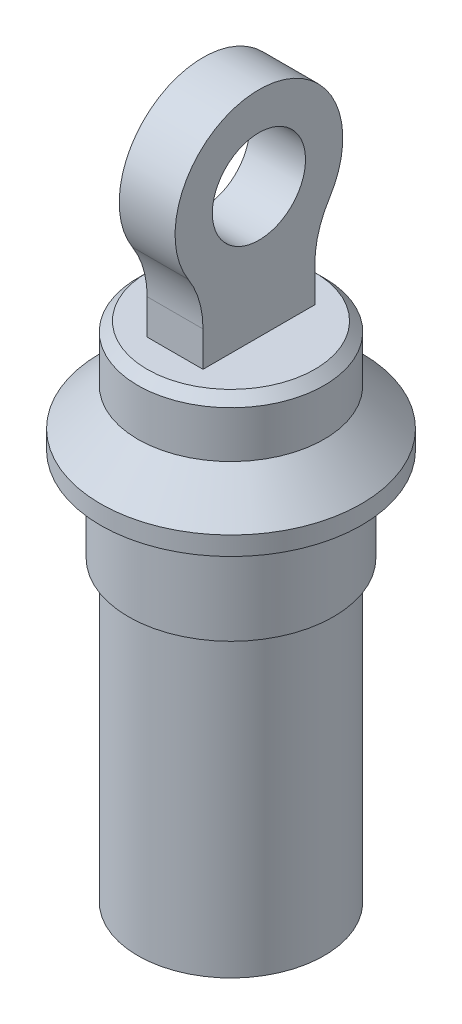
from build123d import *

# Parameters (mm, degrees)
SKETCH1_R            = 5
BOSS_EXTRUDE1_DEPTH  = 8
SKETCH2_R            = 5.5
BOSS_EXTRUDE2_DEPTH  = 5
SKETCH3_R            = 7
BOSS_EXTRUDE3_DEPTH  = 1
CHAMFER2_SIZE        = 0.5
SKETCH48_W           = 2.996334688
SKETCH48_H           = 6
BOSS_EXTRUDE7_DEPTH  = 7
SKETCH50_R           = 4.5
BOSS_EXTRUDE9_DEPTH  = 2.99
BOSS_EXTRUDE10_START = -2.99
SKETCH51_R           = 4.5
BOSS_EXTRUDE10_DEPTH = 2.99
SKETCH52_R           = 2.5
CUT_EXTRUDE1_DEPTH   = 4
BOSS_EXTRUDE11_START = 16
SKETCH56_R           = 5
BOSS_EXTRUDE11_DEPTH = 16
SKETCH57_R           = 3.25
CUT_EXTRUDE7_DEPTH   = 21
SKETCH59_R           = 3.5
CUT_EXTRUDE10_DEPTH  = 26
FILLET1_R            = 5


with BuildPart() as part:
    # Sketch1 → Boss-Extrude1 (new body)
    with BuildSketch(Plane(origin=(0, 0, 0), x_dir=(1, 0, 0), z_dir=(0, 1, 0))):
        with Locations(Location((0, 0, 0), (0, 0, 270))):
            Circle(SKETCH1_R)
    extrude(amount=BOSS_EXTRUDE1_DEPTH)

    # Sketch2 → Boss-Extrude2 (add)
    with BuildSketch(Plane(origin=(0, 8, 0), x_dir=(1, 0, 0), z_dir=(0, 1, 0))):
        with Locations(Location((0, 0, 0), (0, 0, 270))):
            Circle(SKETCH2_R)
    extrude(amount=BOSS_EXTRUDE2_DEPTH)

    # Sketch3 → Boss-Extrude3 (add)
    with BuildSketch(Plane(origin=(0, 13, 0), x_dir=(1, 0, 0), z_dir=(0, 1, 0))):
        with Locations(Location((0, 0, 0), (0, 0, 270))):
            Circle(SKETCH3_R)
    extrude(amount=BOSS_EXTRUDE3_DEPTH)

    # Sketch47 → Revolve1 (revolve)
    with BuildSketch(Plane(origin=(0, 0, 0), x_dir=(0, 0, -1), z_dir=(1, 0, 0))):
        Polygon((0, 14), (0, 19), (5, 19), (5, 16), (7, 14), align=None)
    revolve(axis=Axis((0, 14, 0), (0, 1, 0)))

    # Chamfer2
    chamfer2_edges = [part.edges().sort_by_distance(p)[0] for p in [
        (0, 19, 5),
    ]]
    chamfer(chamfer2_edges, length=CHAMFER2_SIZE)

    # Sketch48 → Boss-Extrude7 (add)
    with BuildSketch(Plane(origin=(0, 19, 0), x_dir=(1, 0, 0), z_dir=(0, 1, 0))):
        Rectangle(SKETCH48_W, SKETCH48_H)
    extrude(amount=BOSS_EXTRUDE7_DEPTH)

    # Sketch50 → Boss-Extrude9 (add)
    with BuildSketch(Plane(origin=(1.498167344, 0, 0), x_dir=(0, 0, -1), z_dir=(1, 0, 0))):
        with Locations((0, 26)):
            Circle(SKETCH50_R)
    extrude(amount=-BOSS_EXTRUDE9_DEPTH)

    # Sketch51 → Boss-Extrude10 (add)
    with BuildSketch(Plane.ZY.offset(1.498167344).offset(BOSS_EXTRUDE10_START)):
        with Locations((0, 26)):
            Circle(SKETCH51_R)
    extrude(amount=BOSS_EXTRUDE10_DEPTH)

    # Sketch52 → Cut-Extrude1 (cut)
    with BuildSketch(Plane.ZY.offset(1.498167344)):
        with Locations((0, 26)):
            Circle(SKETCH52_R)
    extrude(amount=-CUT_EXTRUDE1_DEPTH, mode=Mode.SUBTRACT)

    # Sketch56 → Boss-Extrude11 (add)
    with BuildSketch(Plane.XZ.offset(-8).offset(BOSS_EXTRUDE11_START)):
        with Locations(Location((0, 0, 0), (0, 0, 270))):
            Circle(SKETCH56_R)
    extrude(amount=-BOSS_EXTRUDE11_DEPTH)

    # Sketch57 → Cut-Extrude7 (cut)
    with BuildSketch(Plane.XZ.offset(8)):
        with Locations(Location((0, 0, 0), (0, 0, 270))):
            Circle(SKETCH57_R)
    extrude(amount=-CUT_EXTRUDE7_DEPTH, mode=Mode.SUBTRACT)

    # Sketch59 → Cut-Extrude10 (cut)
    with BuildSketch(Plane(origin=(0, -8, 0), x_dir=(-1, 0, 0), z_dir=(0, -1, 0))):
        with Locations(Location((0, 0, 0), (0, 0, 90))):
            Circle(SKETCH59_R)
    extrude(amount=-CUT_EXTRUDE10_DEPTH, mode=Mode.SUBTRACT)

    # Fillet1
    fillet1_edges = [part.edges().sort_by_distance(p)[0] for p in [
        (0, 22.645898034, 3),
        (0, 22.645898034, -3),
    ]]
    fillet(fillet1_edges, radius=FILLET1_R)


solid = part.part
